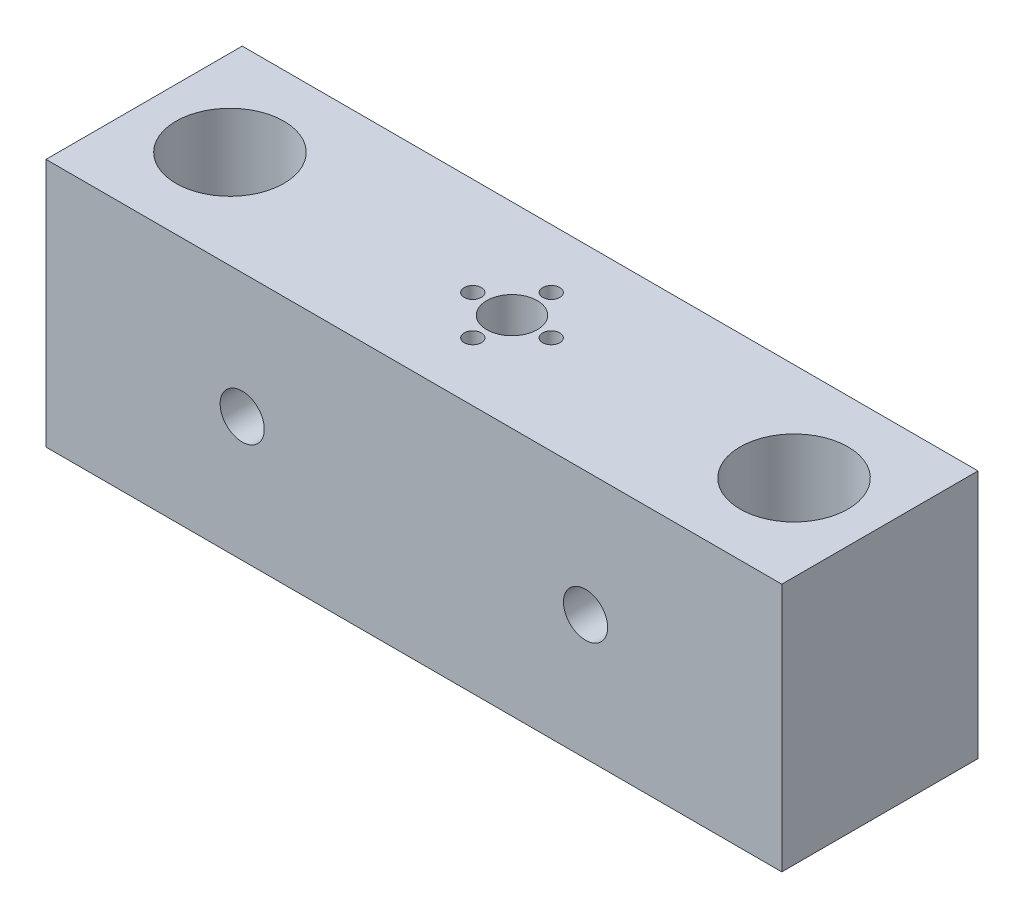
from build123d import *

# Parameters (mm, degrees)
ESBO_O1_W                            = 150
ESBO_O1_H                            = 40
RESSALTO_EXTRUS_O1_DEPTH             = 50.8
CORTE_EXTRUS_O1_DEPTH                = 93.766588813
CORTE_EXTRUS_O1_DEPTH_BACK           = 93.766588813
ESBO_O2_R                            = 5.15
ESBO_O2_R_2                          = 11
ESBO_O3_R                            = 1.75
CORTE_EXTRUS_O2_DEPTH                = 93.766588813
PADR_OCIRCULAR1_COUNT                = 4
ESBO_O5_R                            = 4
CORTE_EXTRUS_O3_DEPTH                = 100.023431571
FURO_ROSCADO_DE_M10X1_01_D           = 9
FURO_ROSCADO_DE_M10X1_01_CSINK_D     = 10.05
FURO_ROSCADO_DE_M10X1_01_CSINK_ANGLE = 90


with BuildPart() as part:
    # Esboço1 → Ressalto-extrusão1 (new body)
    with BuildSketch(Plane(origin=(0, 0, 0), x_dir=(1, 0, 0), z_dir=(0, 1, 0))):
        Rectangle(ESBO_O1_W, ESBO_O1_H)
    extrude(amount=RESSALTO_EXTRUS_O1_DEPTH)

    # Esboço2 → Corte-extrusão1 (cut, two sides: drawn at the far end of the back side and taken through both)
    with BuildSketch(Plane(origin=(0, 50.8, 0), x_dir=(1, 0, 0), z_dir=(0, 1, 0)).offset(-CORTE_EXTRUS_O1_DEPTH_BACK)):
        with Locations(Location((0, 0, 0), (0, 0, 90))):
            Circle(ESBO_O2_R)
        with Locations(Location((-57.5, 0, 0), (0, 0, 90))):
            Circle(ESBO_O2_R_2)
        with Locations(Location((57.5, 0, 0), (0, 0, 90))):
            Circle(ESBO_O2_R_2)
    extrude(amount=CORTE_EXTRUS_O1_DEPTH + CORTE_EXTRUS_O1_DEPTH_BACK, mode=Mode.SUBTRACT)

    # Esboço3 → Corte-extrusão2 (cut, through all)
    with BuildSketch(Plane(origin=(0, 50.8, 0), x_dir=(1, 0, 0), z_dir=(0, 1, 0))):
        with Locations(Location((0, 8, 0), (0, 0, 270))):
            Circle(ESBO_O3_R)
    corte_extrus_o2 = extrude(amount=-CORTE_EXTRUS_O2_DEPTH, mode=Mode.SUBTRACT)

    # PadrãoCircular1: Corte-extrusão2 ×4 about axis
    padr_ocircular1_axis = Axis((0, 0, 0), (0, 1, 0))
    for i in range(1, PADR_OCIRCULAR1_COUNT):
        add(corte_extrus_o2.rotate(padr_ocircular1_axis, i * 360 / PADR_OCIRCULAR1_COUNT), mode=Mode.SUBTRACT)

    # Esboço5 → Corte-extrusão3 (cut, through all)
    with BuildSketch(Plane(origin=(0, 0, -20), x_dir=(-1, 0, 0), z_dir=(0, 0, -1))):
        with Locations((35, 25.4)):
            Circle(ESBO_O5_R)
        with Locations((-35, 25.4)):
            Circle(ESBO_O5_R)
    extrude(amount=-CORTE_EXTRUS_O3_DEPTH, mode=Mode.SUBTRACT)

    # Furo roscado de M10x1.01 (through all)
    with Locations(Plane(origin=(0, 0, -20), x_dir=(-1, 0, 0), z_dir=(0, 0, -1))):
        with Locations((35, 25.4), (-35, 25.4)):
            CounterSinkHole(FURO_ROSCADO_DE_M10X1_01_D / 2, FURO_ROSCADO_DE_M10X1_01_CSINK_D / 2, counter_sink_angle=FURO_ROSCADO_DE_M10X1_01_CSINK_ANGLE)


solid = part.part
